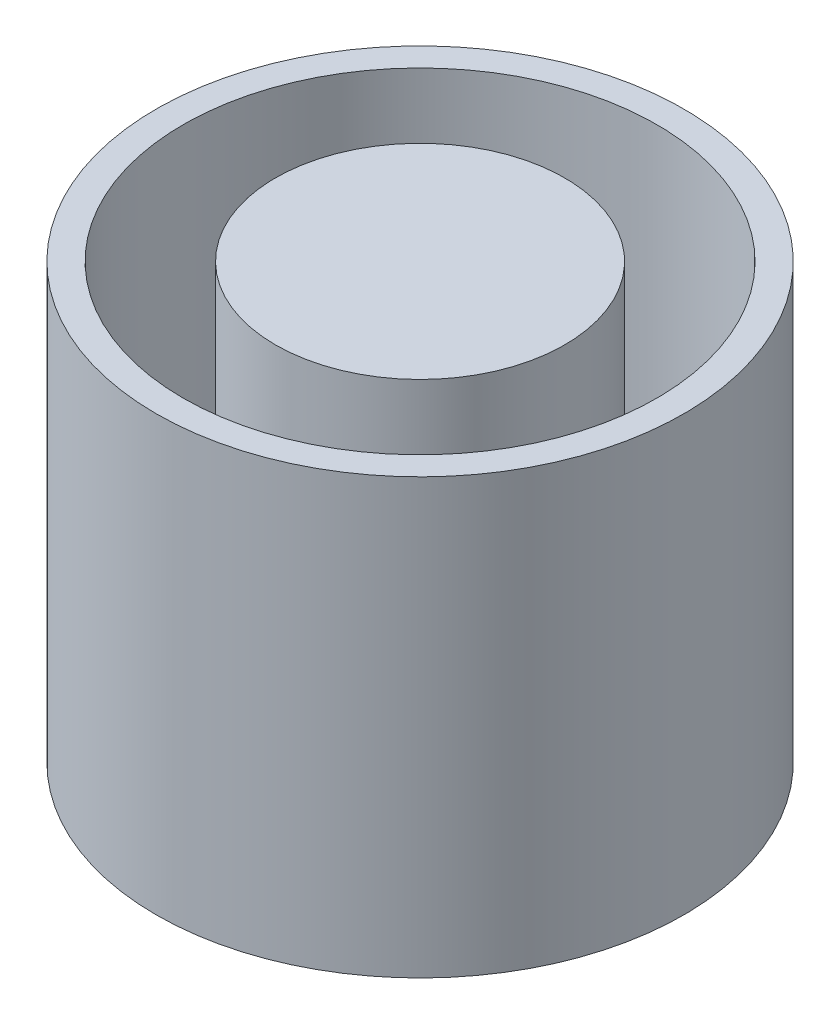
from build123d import *

# Parameters (mm, degrees)
ESBO_O1_R                  = 60.802005659
ESBO_O1_R_2                = 54.579770148
RESSALTO_EXTRUS_O1_DEPTH   = 100
ESBO_O1_R_3                = 33.324434684
ESBO_O1_R_4                = 14.070831149
RESSALTO_EXTRUS_O1_2_DEPTH = 100
ESBO_O3_R                  = 14.070831149
RESSALTO_EXTRUS_O2_DEPTH   = 10
ESBO_O1_3_R                = 54.579770148
ESBO_O1_3_R_2              = 33.324434684
RESSALTO_EXTRUS_O3_DEPTH   = 10


with BuildPart() as part:
    # Esboço1 → Ressalto-extrusão1 (new body)
    with BuildSketch(Plane(origin=(0, 0, 0), x_dir=(1, 0, 0), z_dir=(0, 1, 0))):
        Circle(ESBO_O1_R)
        Circle(ESBO_O1_R_2, mode=Mode.SUBTRACT)
    extrude(amount=RESSALTO_EXTRUS_O1_DEPTH)



with BuildPart() as body_2:
    # Esboço1 → Ressalto-extrus_o1 2 (new body)
    with BuildSketch(Plane(origin=(0, 0, 0), x_dir=(1, 0, 0), z_dir=(0, 1, 0))):
        Circle(ESBO_O1_R_3)
        Circle(ESBO_O1_R_4, mode=Mode.SUBTRACT)
    extrude(amount=RESSALTO_EXTRUS_O1_2_DEPTH)

    # Esboço3 → Ressalto-extrusão2 (add)
    with BuildSketch(Plane(origin=(0, 100, 0), x_dir=(1, 0, 0), z_dir=(0, 1, 0))):
        Circle(ESBO_O3_R)
    extrude(amount=-RESSALTO_EXTRUS_O2_DEPTH)


with BuildPart() as part_1:
    add(part.part)

    add(body_2.part)  # Ressalto-extrusão3 merges body 2
    # Esboço1<3> → Ressalto-extrusão3 (add)
    with BuildSketch(Plane(origin=(0, 0, 0), x_dir=(1, 0, 0), z_dir=(0, 1, 0))):
        Circle(ESBO_O1_3_R)
        Circle(ESBO_O1_3_R_2, mode=Mode.SUBTRACT)
    extrude(amount=RESSALTO_EXTRUS_O3_DEPTH)


solid = part_1.part
